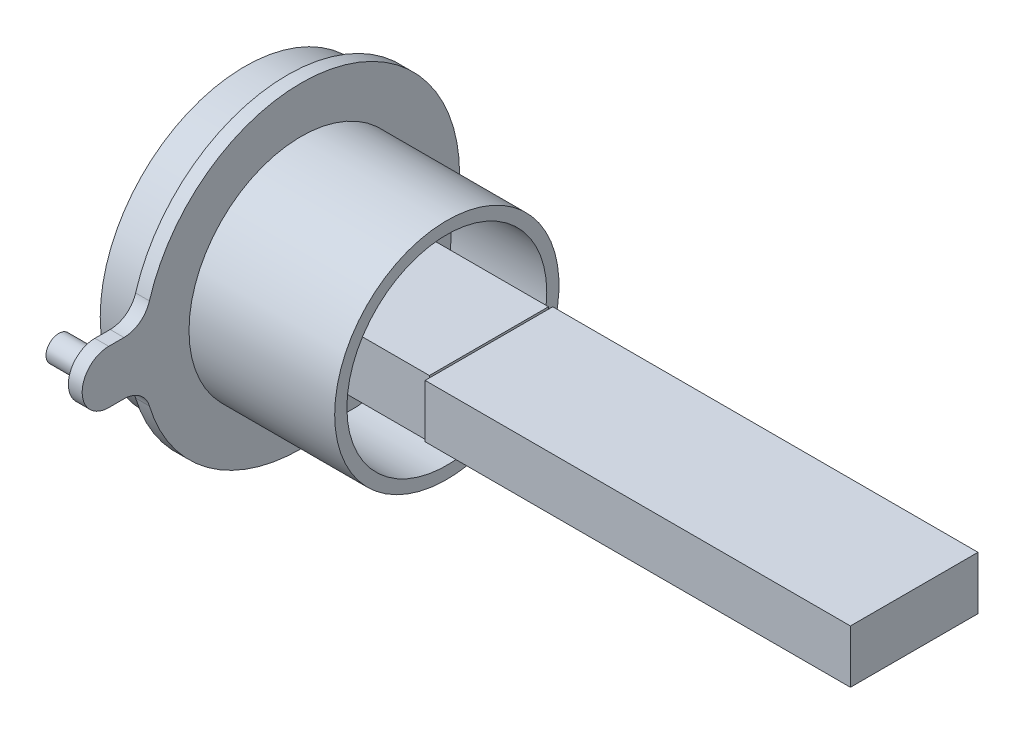
from build123d import *

# Parameters (mm, degrees)
SKETCH2_W      = 12.192
SKETCH2_H      = 10.668
EXTRUDE1_DEPTH = 14.478
SKETCH3_W      = 14.224
SKETCH3_H      = 6.858
EXTRUDE2_DEPTH = 16.4592
EXTRUDE3_START = -1.651
EXTRUDE3_DEPTH = 1.651
FILLET1_R      = 3.175
SKETCH5_R      = 1.524
EXTRUDE4_DEPTH = 4.318
SKETCH6_W      = 15.24
SKETCH6_H      = 6.35
EXTRUDE5_DEPTH = 50.8


with BuildPart() as part:
    # Sketch1 → Revolve1 (revolve)
    with BuildSketch(Plane.XY, mode=Mode.PRIVATE) as revolve1_sk:
        Polygon((0, 13.3985), (17.399, 13.3985), (17.399, 11.938), (5.969, 11.938), (5.969, 0), (3.429, 0), (3.429, 11.938), (-6.731, 11.938), (-6.731, 17.272), (-1.651, 17.272), (-1.651, 18.923), (0, 18.923), align=None)
    revolve(revolve1_sk.sketch.rotate(Axis((-7.9375, 0, 0), (1, 0, 0)), 90), axis=Axis((-7.9375, 0, 0), (1, 0, 0)))

    # Sketch2 → Extrude1 (add)
    with BuildSketch(Plane.ZY.offset(-3.429)):
        Rectangle(SKETCH2_W, SKETCH2_H)
    extrude(amount=EXTRUDE1_DEPTH)

    # Sketch3 → Extrude2 (add)
    with BuildSketch(Plane(origin=(5.969, 0, 0), x_dir=(0, 0, -1), z_dir=(1, 0, 0))):
        Rectangle(SKETCH3_W, SKETCH3_H)
    extrude(amount=EXTRUDE2_DEPTH)

    # Sketch4 → Extrude3 (add)
    with BuildSketch(Plane.ZY.offset(1.651).offset(EXTRUDE3_START)):
        with BuildLine():
            Line((22.987, 3.175), (18.654739451, 3.175))
            ThreePointArc((18.654739451, 3.175), (18.923, 0), (18.654739451, -3.175))
            Line((18.654739451, -3.175), (22.987, -3.175))
            ThreePointArc((22.987, -3.175), (26.162, 0), (22.987, 3.175))
        make_face()
    extrude(amount=EXTRUDE3_DEPTH)

    # Fillet1
    fillet1_edges = [part.edges().sort_by_distance(p)[0] for p in [
        (-0.8255, 3.175, 18.654739451),
        (-0.8255, -3.175, 18.654739451),
    ]]
    fillet(fillet1_edges, radius=FILLET1_R)

    # Sketch5 → Extrude4 (add)
    with BuildSketch(Plane.ZY.offset(1.651)):
        with Locations(Location((22.987, 0, 0), (0, 0, 180))):
            Circle(SKETCH5_R)
    extrude(amount=EXTRUDE4_DEPTH)

    # Sketch6 → Extrude5 (add)
    with BuildSketch(Plane(origin=(22.4282, 0, 0), x_dir=(0, 0, -1), z_dir=(1, 0, 0))):
        Rectangle(SKETCH6_W, SKETCH6_H)
    extrude(amount=EXTRUDE5_DEPTH)


solid = part.part
